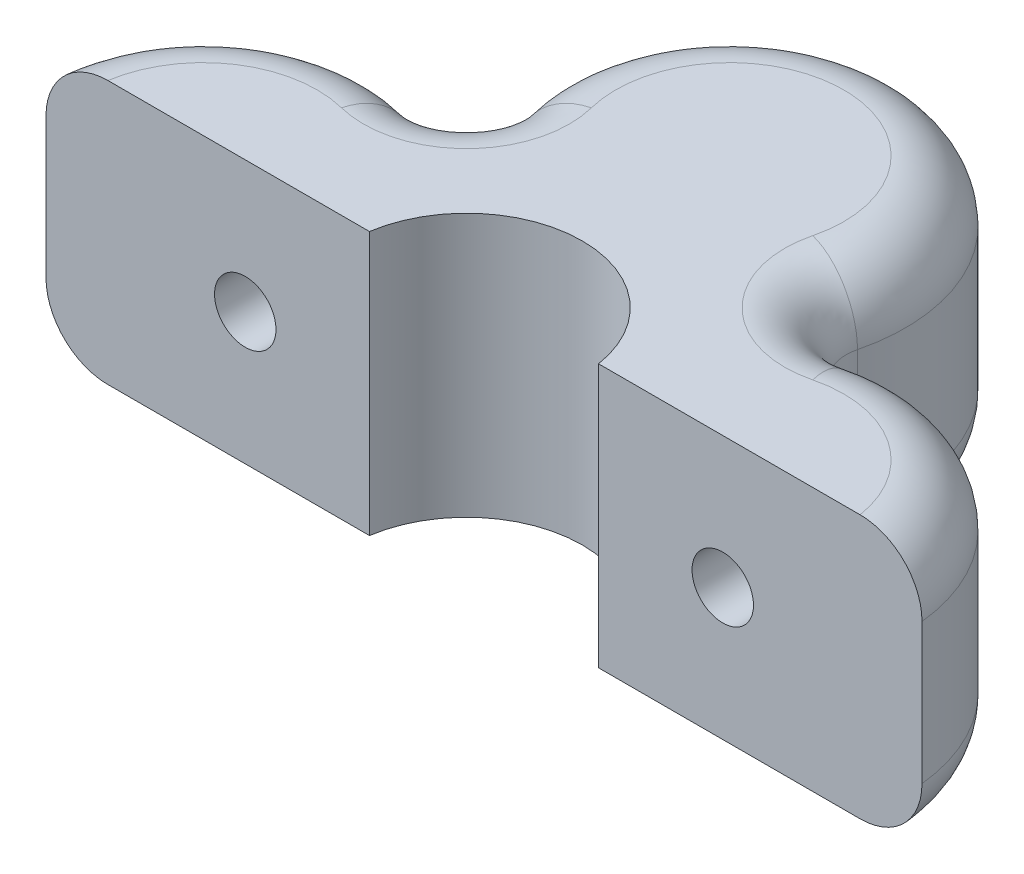
from build123d import *

# Parameters (mm, degrees)
BOSS_EXTRUDE1_DEPTH = 15
BOSS_EXTRUDE2_DEPTH = 15
CUT_EXTRUDE1_REACH  = 40.406
SKETCH2_R           = 1.75
CUT_EXTRUDE4_START  = -15
SKETCH5_W           = 78.790180628
SKETCH5_H           = 1
CUT_EXTRUDE4_DEPTH  = 15
SKETCH3_R           = 3.25
CUT_EXTRUDE2_DEPTH  = 9
FILLET1_R           = 3.5


with BuildPart() as part:
    # Sketch1 → Boss-Extrude1 (new body)
    with BuildSketch(Plane(origin=(0, 0, 0), x_dir=(1, 0, 0), z_dir=(0, 1, 0))):
        with BuildLine():
            Line((-6.6, 0), (-14.6, 0))
            ThreePointArc((-14.6, 0), (0, 14.6), (14.6, 0))
            Line((14.6, 0), (6.6, 0))
            ThreePointArc((6.6, 0), (0, 6.6), (-6.6, 0))
        make_face()
    extrude(amount=BOSS_EXTRUDE1_DEPTH)

    # Sketch6 → Boss-Extrude2 (add)
    with BuildSketch(Plane.XZ):
        with BuildLine():
            Line((-25, 0), (-8.641827511, 0))
            ThreePointArc((-8.641827511, 0), (0, -8.641827511), (8.641827511, 0))
            Line((8.641827511, 0), (25, 0))
            ThreePointArc((25, 0), (21.153421014, -7.882601717), (12.572918035, -9.70099341))
            ThreePointArc((12.572918035, -9.70099341), (11.366290804, -9.716055468), (10.323759005, -10.323759005))
            ThreePointArc((10.323759005, -10.323759005), (9.716055468, -11.366290804), (9.70099341, -12.572918035))
            ThreePointArc((9.70099341, -12.572918035), (0, -25), (-9.70099341, -12.572918035))
            ThreePointArc((-9.70099341, -12.572918035), (-9.716055468, -11.366290804), (-10.323759005, -10.323759005))
            ThreePointArc((-10.323759005, -10.323759005), (-11.366290804, -9.716055468), (-12.572918035, -9.70099341))
            ThreePointArc((-12.572918035, -9.70099341), (-21.153421014, -7.882601717), (-25, 0))
        make_face()
    extrude(amount=-BOSS_EXTRUDE2_DEPTH)

    # Sketch2 → Cut-Extrude1 (cut, up to next)
    with BuildSketch(Plane(origin=(0, 0, 0), x_dir=(-1, 0, 0), z_dir=(0, 0, -1)), mode=Mode.PRIVATE) as cut_extrude1_sk1:
        with Locations(Location((-13.6, 7.5, 0), (0, 0, 54.062388323))):
            Circle(SKETCH2_R)
    cut_extrude1_tool1 = extrude(cut_extrude1_sk1.sketch, amount=CUT_EXTRUDE1_REACH, mode=Mode.PRIVATE) & part.part
    # Sketch2 → Cut-Extrude1 (cut, up to next)
    with BuildSketch(Plane(origin=(0, 0, 0), x_dir=(-1, 0, 0), z_dir=(0, 0, -1)), mode=Mode.PRIVATE) as cut_extrude1_sk2:
        with Locations(Location((13.6, 7.5, 0), (0, 0, 234.062388323))):
            Circle(SKETCH2_R)
    cut_extrude1_tool2 = extrude(cut_extrude1_sk2.sketch, amount=CUT_EXTRUDE1_REACH, mode=Mode.PRIVATE) & part.part
    add(cut_extrude1_tool1.solids().sort_by_distance((13.6, 7.5, 0))[0], mode=Mode.SUBTRACT)
    add(cut_extrude1_tool2.solids().sort_by_distance((-13.6, 7.5, 0))[0], mode=Mode.SUBTRACT)

    # Sketch5 → Cut-Extrude4 (cut)
    with BuildSketch(Plane(origin=(0, 15, 0), x_dir=(1, 0, 0), z_dir=(0, 1, 0)).offset(CUT_EXTRUDE4_START)):
        with Locations((-1.565702307, 0.5)):
            Rectangle(SKETCH5_W, SKETCH5_H)
    extrude(amount=CUT_EXTRUDE4_DEPTH, mode=Mode.SUBTRACT)

    # Sketch3 → Cut-Extrude2 (cut)
    with BuildSketch(Plane.XY.offset(-15)):
        with Locations(Location((13.6, 7.5, 0), (0, 0, 180))):
            Circle(SKETCH3_R)
        Polygon((-10.8, 5.883419246), (-10.8, 9.116580754), (-13.6, 10.733161507), (-16.4, 9.116580754), (-16.4, 5.883419246), (-13.6, 4.266838493), align=None)
    extrude(amount=CUT_EXTRUDE2_DEPTH, mode=Mode.SUBTRACT)

    # Fillet1
    fillet1_edges = [part.edges().sort_by_distance(p)[0] for p in [
        (10.323759005, 0, -10.323759005),
        (20.751080157, 0, -8.180774843),
        (-10.323759005, 0, -10.323759005),
        (0, 0, -25),
        (10.323759005, 15, -10.323759005),
        (-10.323759005, 15, -10.323759005),
        (-20.751080157, 15, -8.180774843),
        (0, 15, -25),
        (-20.751080157, 0, -8.180774843),
        (20.751080157, 15, -8.180774843),
    ]]
    fillet(fillet1_edges, radius=FILLET1_R)


solid = part.part
